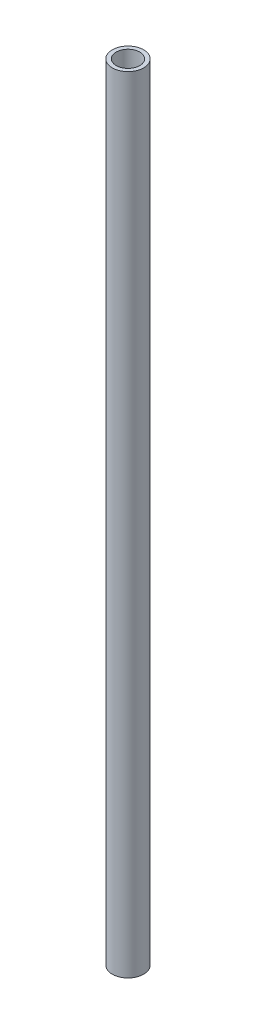
from build123d import *

# Parameters (mm, degrees)
SKETCH_1_R      = 4
SKETCH_1_R_2    = 3
EXTRUDE_1_DEPTH = 200


with BuildPart() as part:
    # 草图1 → 凸台-拉伸1 (new body)
    with BuildSketch(Plane(origin=(0, 0, 0), x_dir=(1, 0, 0), z_dir=(0, 1, 0))):
        with Locations(Location((0, 0, 0), (0, 0, 270))):
            Circle(SKETCH_1_R)
        with Locations(Location((0, 0, 0), (0, 0, 270))):
            Circle(SKETCH_1_R_2, mode=Mode.SUBTRACT)
    extrude(amount=EXTRUDE_1_DEPTH)


solid = part.part
